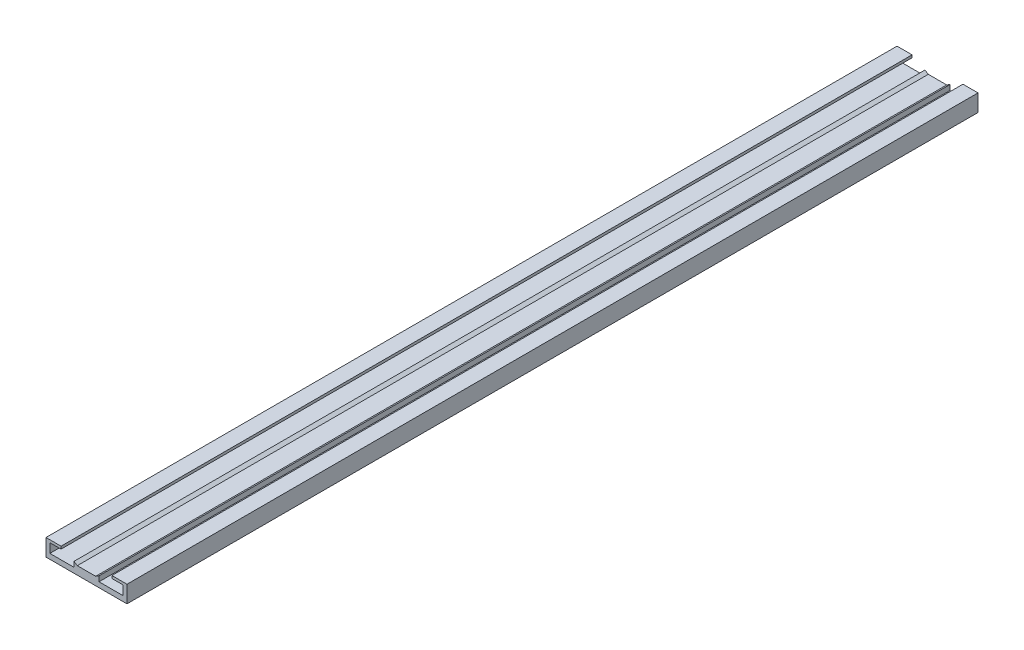
from build123d import *

# Parameters (mm, degrees)
BOSS_EXTRUDE1_DEPTH = 419.1


with BuildPart() as part:
    # Sketch1 → Boss-Extrude1 (new body)
    with BuildSketch(Plane.XY):
        Polygon((0, 0), (19.939, 0), (19.939, 8.382), (12.5222, 8.382), (12.5222, 7.112), (18.034, 7.112), (18.034, 2.54), (6.1722, 2.54), (6.1722, 5.08), (4.530801767, 4.064), (-4.530801767, 4.064), (-6.1722, 5.08), (-6.1722, 2.54), (-18.034, 2.54), (-18.034, 7.112), (-12.5222, 7.112), (-12.5222, 8.382), (-19.939, 8.382), (-19.939, 0), align=None)
    extrude(amount=BOSS_EXTRUDE1_DEPTH)


solid = part.part
